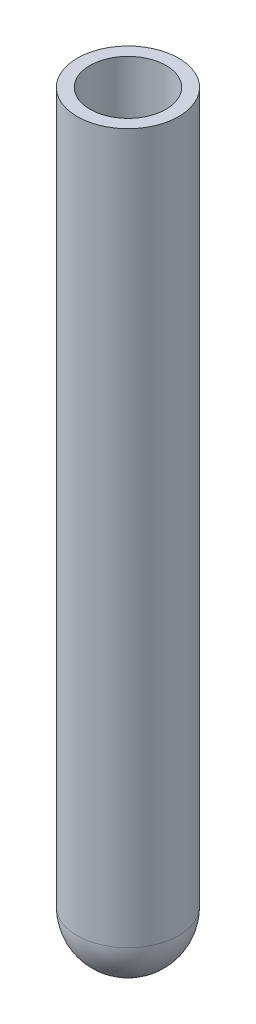
from build123d import *

# Parameters (mm, degrees)
SKETCH3_R           = 5
SKETCH3_R_2         = 3.75
BOSS_EXTRUDE1_DEPTH = 70


with BuildPart() as part:
    # Sketch2 → Revolve1 (revolve)
    with BuildSketch(Plane.XY):
        with BuildLine():
            Line((-5, 0), (0, 0))
            Line((0, 0), (0, -5))
            ThreePointArc((0, -5), (-3.535533906, -3.535533906), (-5, 0))
        make_face()
    revolve(axis=Axis((0, 0, 0), (0, 1, 0)))

    # Sketch3 → Boss-Extrude1 (add)
    with BuildSketch(Plane(origin=(0, 0, 0), x_dir=(1, 0, 0), z_dir=(0, 1, 0))):
        with Locations(Location((0, 0, 0), (0, 0, 270))):
            Circle(SKETCH3_R)
        with Locations(Location((0, 0, 0), (0, 0, 270))):
            Circle(SKETCH3_R_2, mode=Mode.SUBTRACT)
    extrude(amount=BOSS_EXTRUDE1_DEPTH)


solid = part.part
